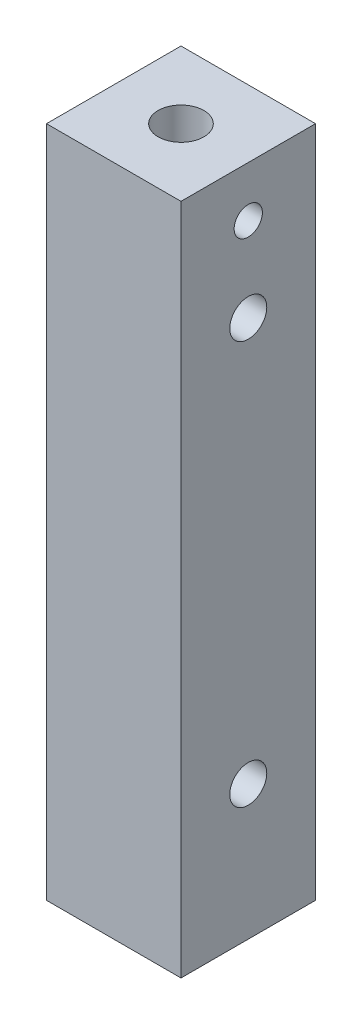
from build123d import *

# Parameters (mm, degrees)
SKETCH1_W             = 20
SKETCH1_H             = 20
BOSS_EXTRUDE1_DEPTH   = 100
M5_CLEARANCE_HOLE1_D  = 5.5
M5_TAPPED_HOLE3_D     = 4.2
M5_TAPPED_HOLE3_DEPTH = 10.4
M5_TAPPED_HOLE3_TIP   = 1.2618073


with BuildPart() as part:
    # Sketch1 → Boss-Extrude1 (new body)
    with BuildSketch(Plane(origin=(0, 0, 0), x_dir=(1, 0, 0), z_dir=(0, 1, 0))):
        with Locations((10, 10)):
            Rectangle(SKETCH1_W, SKETCH1_H)
    extrude(amount=BOSS_EXTRUDE1_DEPTH)

    # Sketch5 → M8 Tapped Hole1 (revolve, cut)
    with BuildSketch(Plane(origin=(10, 100, -10), x_dir=(0, 0, 1), z_dir=(1, 0, 0))):
        Polygon((0, 0), (0, 15.792926105), (3.4, 13.75), (3.4, 0), align=None)
    m8_tapped_hole1 = revolve(axis=Axis((10, 106.35, -10), (0, -1, 0)), mode=Mode.SUBTRACT)

    # Mirror1: M8 Tapped Hole1 across plane
    add(m8_tapped_hole1.mirror(Plane.ZX.offset(50)), mode=Mode.SUBTRACT)

    # M5 Clearance Hole1 (through all)
    with Locations(Plane(origin=(20, 0, 0), x_dir=(0, 0, -1), z_dir=(1, 0, 0))):
        with Locations((10, 20), (10, 80)):
            Hole(M5_CLEARANCE_HOLE1_D / 2)

    # M5 Tapped Hole3
    with Locations(Plane(origin=(20, 0, 0), x_dir=(0, 0, -1), z_dir=(1, 0, 0))):
        with Locations((10, 92.5)):
            Hole(M5_TAPPED_HOLE3_D / 2, depth=M5_TAPPED_HOLE3_DEPTH)
            with Locations((0, 0, -(M5_TAPPED_HOLE3_DEPTH + M5_TAPPED_HOLE3_TIP / 2))):  # 118° drill point
                Cone(0, M5_TAPPED_HOLE3_D / 2, M5_TAPPED_HOLE3_TIP, mode=Mode.SUBTRACT)


solid = part.part
